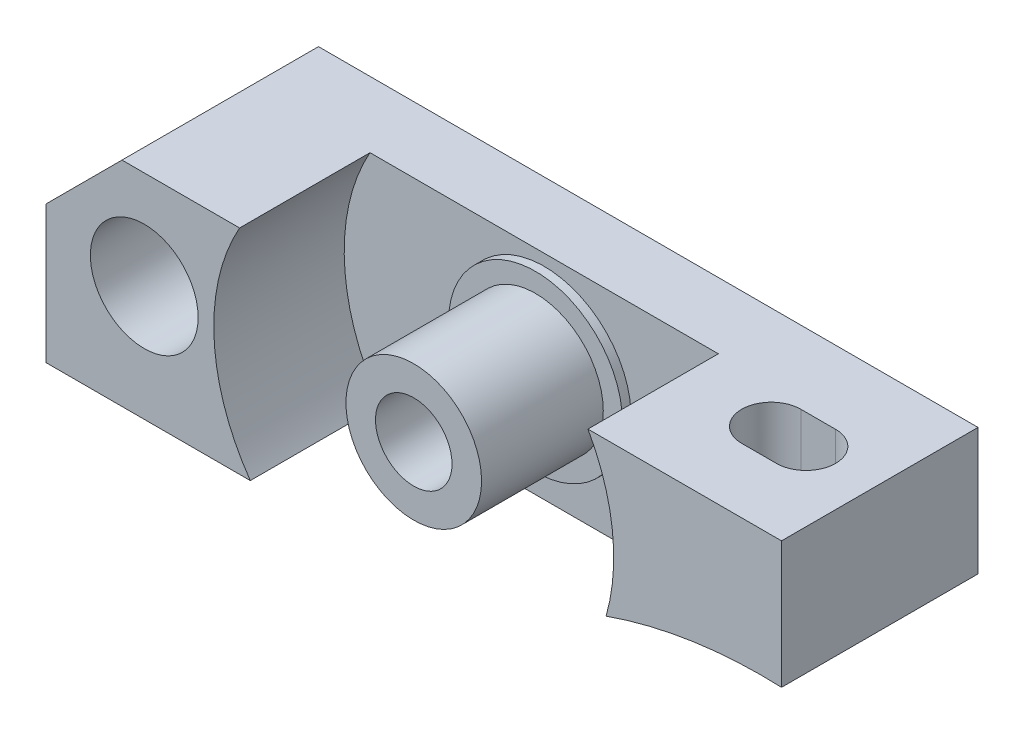
from build123d import *

# Parameters (mm, degrees)
SCHIZZO1_R                   = 1.725
ESTRUSIONE_ESTRUSIONE1_DEPTH = 3.8
SCHIZZO2_R                   = 1.725
ESTRUSIONE_ESTRUSIONE2_DEPTH = 7.5
SCHIZZO4_R                   = 3.1
TAGLIO_ESTRUSIONE1_DEPTH     = 5.65
SCHIZZO5_R                   = 5
ESTRUSIONE_ESTRUSIONE3_DEPTH = 0.5
SCHIZZO6_R                   = 3.9
ESTRUSIONE_ESTRUSIONE4_DEPTH = 7
SCHIZZO7_R                   = 2.2
TAGLIO_ESTRUSIONE2_DEPTH     = 25.75240203
TAGLIO_ESTRUSIONE3_DEPTH     = 25.75240203
TAGLIO_ESTRUSIONE4_DEPTH     = 27.938599166


with BuildPart() as part:
    # Schizzo1 → Estrusione-Estrusione1 (new body)
    with BuildSketch(Plane.XY):
        Polygon((-21.15, 1.7675), (-16.78, 6.1375), (21.15, 6.1375), (21.15, -6.1375), (-21.15, -6.1375), align=None)
        with Locations(Location((-15.5, 0.4875, 0), (0, 0, 180))):
            Circle(SCHIZZO1_R, mode=Mode.SUBTRACT)
    extrude(amount=ESTRUSIONE_ESTRUSIONE1_DEPTH)

    # Schizzo2 → Estrusione-Estrusione2 (add)
    # profile 1 of 2: a face of its own
    with BuildSketch(Plane.XY.offset(3.8)):
        with BuildLine():
            Line((-10.016361615, 6.1375), (-16.78, 6.1375))
            Line((-16.78, 6.1375), (-21.15, 1.7675))
            Line((-21.15, 1.7675), (-21.15, -6.1375))
            Line((-21.15, -6.1375), (-9.399966755, -6.1375))
            ThreePointArc((-9.399966755, -6.1375), (-11.485528203, -0.089251164), (-10.016361615, 6.1375))
        make_face()
        with Locations(Location((-15.5, 0.4875, 0), (0, 0, 180))):
            Circle(SCHIZZO2_R, mode=Mode.SUBTRACT)
    # profile 2 of 2: a face of its own
    with BuildSketch(Plane.XY.offset(3.8)):
        with BuildLine():
            Line((9.399966755, -6.1375), (21.15, -6.1375))
            Line((21.15, -6.1375), (21.15, 6.1375))
            Line((21.15, 6.1375), (10.016361615, 6.1375))
            ThreePointArc((10.016361615, 6.1375), (11.485528203, -0.089251164), (9.399966755, -6.1375))
        make_face()
    extrude(amount=ESTRUSIONE_ESTRUSIONE2_DEPTH)

    # Schizzo4 → Taglio-Estrusione1 (cut)
    with BuildSketch(Plane.XY.offset(11.3)):
        with Locations((-15.5, 0.4875)):
            Circle(SCHIZZO4_R)
    extrude(amount=-TAGLIO_ESTRUSIONE1_DEPTH, mode=Mode.SUBTRACT)

    # Schizzo5 → Estrusione-Estrusione3 (add)
    with BuildSketch(Plane.XY.offset(3.8)):
        with Locations(Location((0, 0.4875, 0), (0, 0, 180))):
            Circle(SCHIZZO5_R)
    extrude(amount=ESTRUSIONE_ESTRUSIONE3_DEPTH)

    # Schizzo6 → Estrusione-Estrusione4 (add)
    with BuildSketch(Plane.XY.offset(4.3)):
        with Locations((0, 0.4875)):
            Circle(SCHIZZO6_R)
    extrude(amount=ESTRUSIONE_ESTRUSIONE4_DEPTH)

    # Schizzo7 → Taglio-Estrusione2 (cut, through all)
    with BuildSketch(Plane.XY.offset(11.3)):
        with Locations((0, 0.4875)):
            Circle(SCHIZZO7_R)
    extrude(amount=-TAGLIO_ESTRUSIONE2_DEPTH, mode=Mode.SUBTRACT)

    # Schizzo8 → Taglio-Estrusione3 (cut, through all)
    with BuildSketch(Plane.XY.offset(11.3)):
        with BuildLine():
            Line((21.15, -6.1375), (21.15, -1.1616))
            ThreePointArc((21.15, -1.1616), (12.330643665, -2.247470782), (4.341411274, -6.1375))
            Line((4.341411274, -6.1375), (21.15, -6.1375))
        make_face()
    extrude(amount=-TAGLIO_ESTRUSIONE3_DEPTH, mode=Mode.SUBTRACT)

    # Schizzo9 → Taglio-Estrusione4 (cut, through all)
    with BuildSketch(Plane(origin=(0, 6.1375, 0), x_dir=(1, 0, 0), z_dir=(0, 1, 0))):
        with BuildLine():
            Line((17.15, -7.59), (15.15, -7.59))
            ThreePointArc((15.15, -7.59), (13.45, -5.89), (15.15, -4.19))
            Line((15.15, -4.19), (17.15, -4.19))
            ThreePointArc((17.15, -4.19), (18.85, -5.89), (17.15, -7.59))
        make_face()
    extrude(amount=-TAGLIO_ESTRUSIONE4_DEPTH, mode=Mode.SUBTRACT)


solid = part.part
